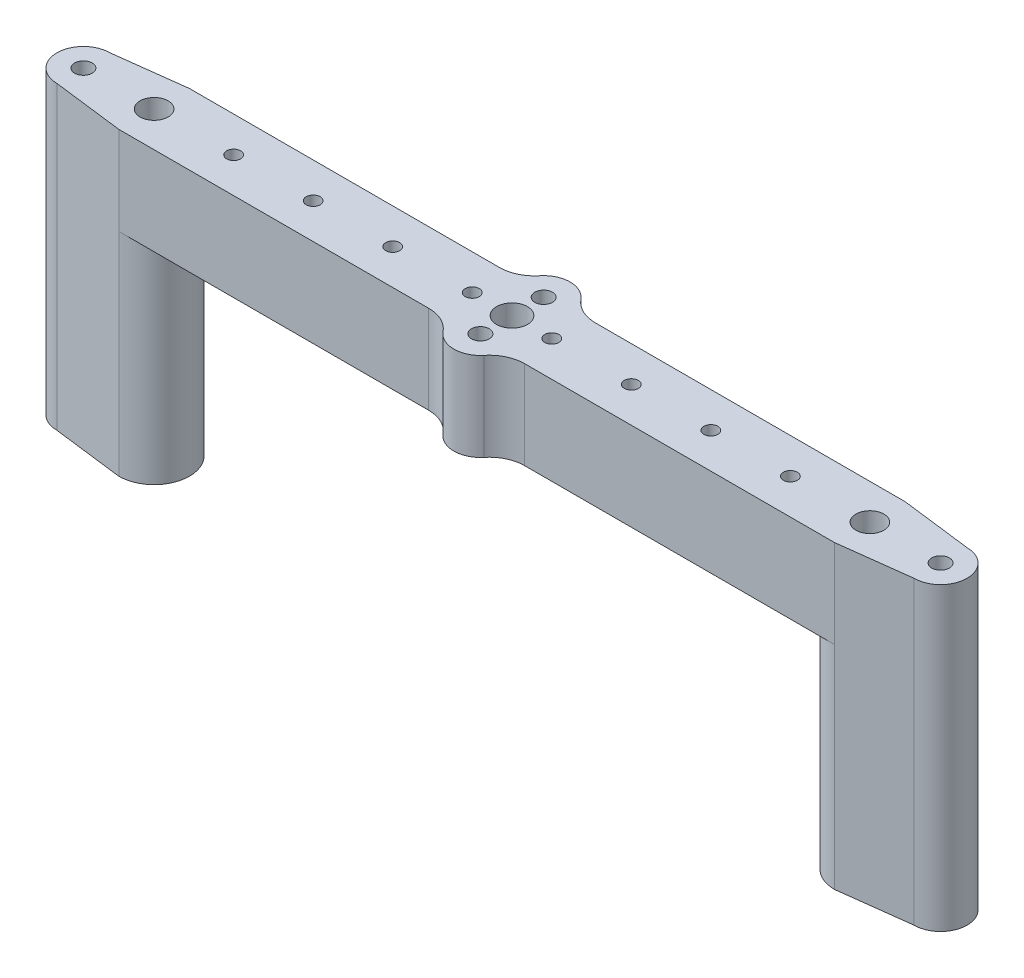
from build123d import *

# Parameters (mm, degrees)
SKETCH1_R                 = 1.5875
SKETCH1_R_2               = 1
BOSS_EXTRUDE1_DEPTH       = 24
BOSS_EXTRUDE1_2_DEPTH     = 24
BOSS_EXTRUDE2_START       = 10
SKETCH2_R                 = 0.79375
SKETCH2_R_2               = 1.5875
SKETCH2_R_3               = 1
SKETCH2_R_4               = 1.75
BOSS_EXTRUDE2_DEPTH       = 10
M3X0_5_TAPPED_HOLE1_D     = 2.5
M3X0_5_TAPPED_HOLE1_DEPTH = 18.5
M3X0_5_TAPPED_HOLE1_TIP   = 0.751075774


with BuildPart() as part:
    # Sketch1 → Boss-Extrude1 (new body)
    with BuildSketch(Plane(origin=(0, 0, 0), x_dir=(1, 0, 0), z_dir=(0, 1, 0))):
        with BuildLine():
            Line((-40.5, 4), (-48.5, 3))
            ThreePointArc((-48.5, 3), (-51.5, 0), (-48.5, -3))
            Line((-48.5, -3), (-40.5, -4))
            ThreePointArc((-40.5, -4), (-36.5, 0), (-40.5, 4))
        make_face()
        with Locations(Location((-40.5, 0, 0), (0, 0, 270))):
            Circle(SKETCH1_R, mode=Mode.SUBTRACT)
        with Locations(Location((-48.5, 0, 0), (0, 0, 270))):
            Circle(SKETCH1_R_2, mode=Mode.SUBTRACT)
    extrude(amount=-BOSS_EXTRUDE1_DEPTH)



with BuildPart() as body_2:
    # Sketch1 → Boss-Extrude1 2 (new body)
    with BuildSketch(Plane(origin=(0, 0, 0), x_dir=(1, 0, 0), z_dir=(0, 1, 0))):
        with BuildLine():
            Line((48.5, -3), (40.5, -4))
            ThreePointArc((40.5, -4), (36.5, 0), (40.5, 4))
            Line((40.5, 4), (48.5, 3))
            ThreePointArc((48.5, 3), (51.5, 0), (48.5, -3))
        make_face()
        with Locations(Location((40.5, 0, 0), (0, 0, 90))):
            Circle(SKETCH1_R, mode=Mode.SUBTRACT)
        with Locations(Location((48.5, 0, 0), (0, 0, 90))):
            Circle(SKETCH1_R_2, mode=Mode.SUBTRACT)
    extrude(amount=-BOSS_EXTRUDE1_2_DEPTH)


with BuildPart() as part_1:
    add(part.part)

    add(body_2.part)  # Boss-Extrude2 merges body 2
    # Sketch2 → Boss-Extrude2 (add)
    with BuildSketch(Plane(origin=(0, 0, 0), x_dir=(1, 0, 0), z_dir=(0, 1, 0)).offset(BOSS_EXTRUDE2_START)):
        with BuildLine():
            Line((-40.5, 4), (-48.5, 3))
            ThreePointArc((-48.5, 3), (-51.5, 0), (-48.5, -3))
            Line((-48.5, -3), (-40.5, -4))
            Line((-40.5, -4), (-5.427594702, -4))
            ThreePointArc((-5.427594702, -4), (-3.710635508, -4.387237743), (-2.326112015, -5.473974438))
            ThreePointArc((-2.326112015, -5.473974438), (0, -6.579455266), (2.326112015, -5.473974438))
            ThreePointArc((2.326112015, -5.473974438), (3.710635508, -4.387237743), (5.427594702, -4))
            Line((5.427594702, -4), (40.5, -4))
            Line((40.5, -4), (48.5, -3))
            ThreePointArc((48.5, -3), (51.5, 0), (48.5, 3))
            Line((48.5, 3), (40.5, 4))
            Line((40.5, 4), (5.427594702, 4))
            ThreePointArc((5.427594702, 4), (3.710635508, 4.387237743), (2.326112015, 5.473974438))
            ThreePointArc((2.326112015, 5.473974438), (0, 6.579455266), (-2.326112015, 5.473974438))
            ThreePointArc((-2.326112015, 5.473974438), (-3.710635508, 4.387237743), (-5.427594702, 4))
            Line((-5.427594702, 4), (-40.5, 4))
        make_face()
        with Locations(Location((-31.5, 0, 0), (0, 0, 270))):
            Circle(SKETCH2_R, mode=Mode.SUBTRACT)
        with Locations(Location((-22.5, 0, 0), (0, 0, 270))):
            Circle(SKETCH2_R, mode=Mode.SUBTRACT)
        with Locations(Location((-40.5, 0, 0), (0, 0, 270))):
            Circle(SKETCH2_R_2, mode=Mode.SUBTRACT)
        with Locations(Location((40.5, 0, 0), (0, 0, 90))):
            Circle(SKETCH2_R_2, mode=Mode.SUBTRACT)
        with Locations(Location((-13.5, 0, 0), (0, 0, 270))):
            Circle(SKETCH2_R, mode=Mode.SUBTRACT)
        with Locations(Location((-4.5, 0, 0), (0, 0, 270))):
            Circle(SKETCH2_R, mode=Mode.SUBTRACT)
        with Locations(Location((4.5, 0, 0), (0, 0, 270))):
            Circle(SKETCH2_R, mode=Mode.SUBTRACT)
        with Locations(Location((13.5, 0, 0), (0, 0, 270))):
            Circle(SKETCH2_R, mode=Mode.SUBTRACT)
        with Locations(Location((22.5, 0, 0), (0, 0, 270))):
            Circle(SKETCH2_R, mode=Mode.SUBTRACT)
        with Locations(Location((31.5, 0, 0), (0, 0, 270))):
            Circle(SKETCH2_R, mode=Mode.SUBTRACT)
        with Locations(Location((48.5, 0, 0), (0, 0, 90))):
            Circle(SKETCH2_R_3, mode=Mode.SUBTRACT)
        with Locations(Location((-48.5, 0, 0), (0, 0, 270))):
            Circle(SKETCH2_R_3, mode=Mode.SUBTRACT)
        with Locations(Location((0, 0, 0), (0, 0, 270))):
            Circle(SKETCH2_R_4, mode=Mode.SUBTRACT)
        with Locations(Location((0, -3.579455266, 0), (0, 0, 270))):
            Circle(SKETCH2_R_3, mode=Mode.SUBTRACT)
        with Locations(Location((0, 3.579455266, 0), (0, 0, 270))):
            Circle(SKETCH2_R_3, mode=Mode.SUBTRACT)
    extrude(amount=-BOSS_EXTRUDE2_DEPTH)

    # M3x0.5 Tapped Hole1
    with Locations(Plane(origin=(-48.5, -24, 0), x_dir=(0, 0, -1), z_dir=(0, -1, 0))):
        with Locations((0, 0), (0, 97)):
            Hole(M3X0_5_TAPPED_HOLE1_D / 2, depth=M3X0_5_TAPPED_HOLE1_DEPTH)
            with Locations((0, 0, -(M3X0_5_TAPPED_HOLE1_DEPTH + M3X0_5_TAPPED_HOLE1_TIP / 2))):  # 118° drill point
                Cone(0, M3X0_5_TAPPED_HOLE1_D / 2, M3X0_5_TAPPED_HOLE1_TIP, mode=Mode.SUBTRACT)


solid = part_1.part
